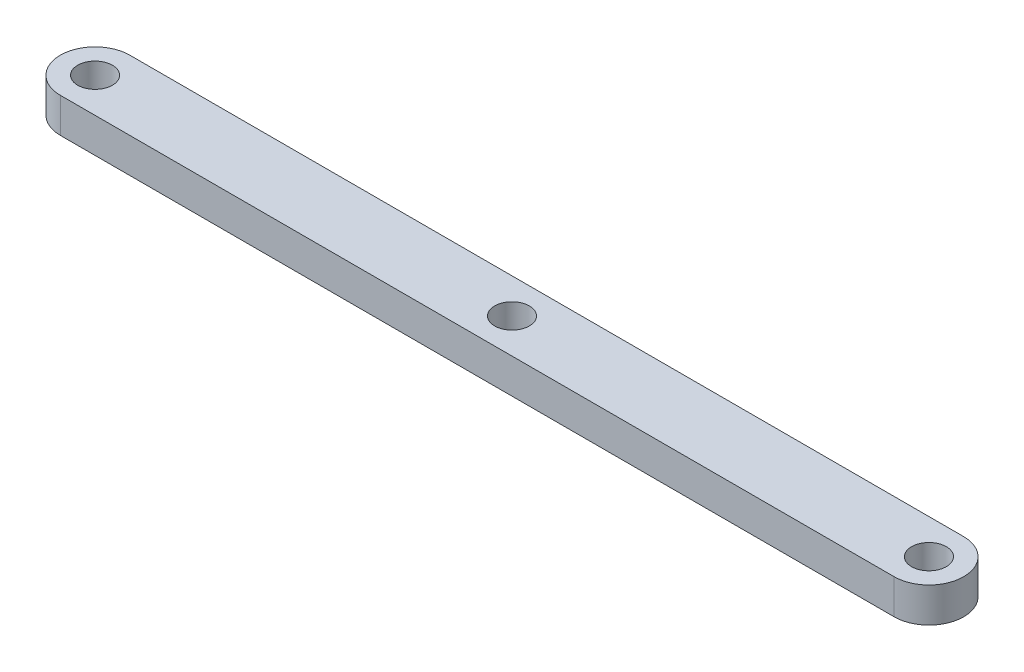
from build123d import *

# Parameters (mm, degrees)
BOSS_EXTRUDE1_DEPTH = 6.35
SKETCH2_R           = 3.175
CUT_EXTRUDE1_DEPTH  = 160.003797124


with BuildPart() as part:
    # Sketch1 → Boss-Extrude1 (new body)
    with BuildSketch(Plane(origin=(0, 0, 0), x_dir=(1, 0, 0), z_dir=(0, 1, 0))):
        with BuildLine():
            Line((0, -6.35), (-152.4, -6.35))
            ThreePointArc((-152.4, -6.35), (-158.75, 0), (-152.4, 6.35))
            Line((-152.4, 6.35), (0, 6.35))
            ThreePointArc((0, 6.35), (6.35, 0), (0, -6.35))
        make_face()
    extrude(amount=BOSS_EXTRUDE1_DEPTH)

    # Sketch2 → Cut-Extrude1 (cut, through all)
    with BuildSketch(Plane(origin=(0, 6.35, 0), x_dir=(1, 0, 0), z_dir=(0, 1, 0))):
        with Locations(Location((-152.4, 0, 0), (0, 0, 270))):
            Circle(SKETCH2_R)
        with Locations(Location((0, 0, 0), (0, 0, 270))):
            Circle(SKETCH2_R)
        with Locations(Location((-76.2, 0, 0), (0, 0, 270))):
            Circle(SKETCH2_R)
    extrude(amount=-CUT_EXTRUDE1_DEPTH, mode=Mode.SUBTRACT)


solid = part.part
